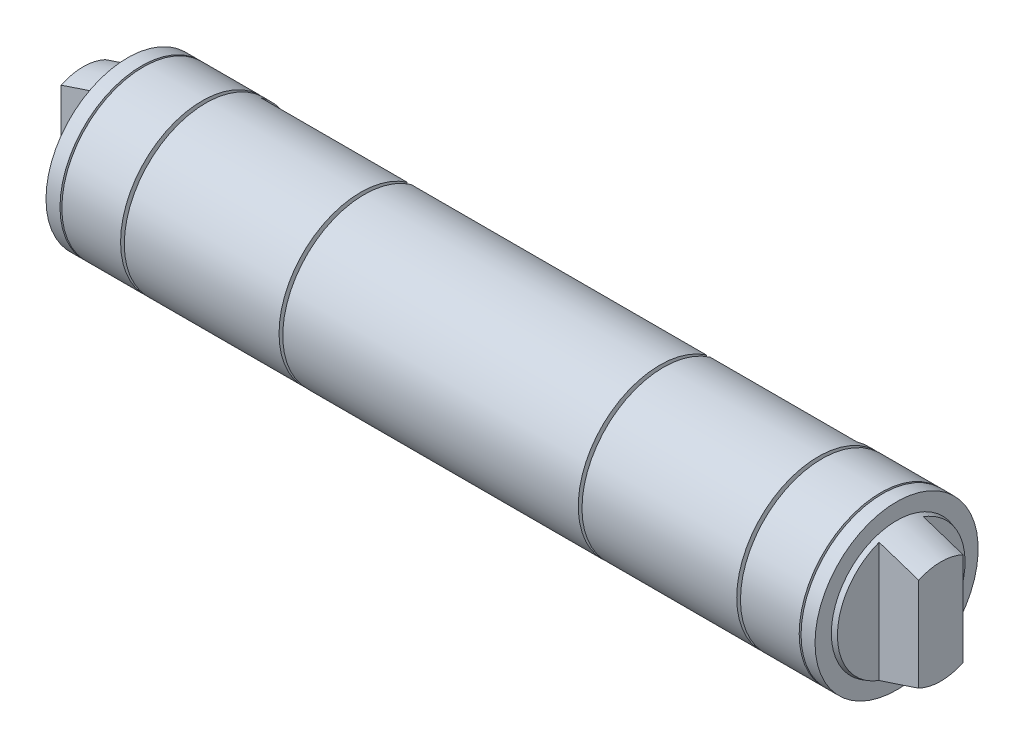
from build123d import *

# Parameters (mm, degrees)
CUT_EXTRUDE_1_DEPTH      = 167.845737135
CUT_EXTRUDE_1_DEPTH_BACK = 167.845737135
SKETCH_2_W               = 128
SKETCH_2_H               = 19.899130277
SKETCH_3_R               = 14
EXTRUDE_1_DEPTH          = 9.5
EXTRUDE_1_TAPER          = 17
SKETCH_4_W               = 17.504538799
SKETCH_4_H               = 43.451593783
CUT_EXTRUDE_2_DEPTH      = 8.5
SKETCH_5_R               = 14
EXTRUDE_2_DEPTH          = 9.5
EXTRUDE_2_TAPER          = 17
SKETCH_6_W               = 11.469588706
SKETCH_6_H               = 34.444631615
CUT_EXTRUDE_3_DEPTH      = 8.5


with BuildPart() as part:
    # Эскиз1 → Повернуть1 (revolve)
    with BuildSketch(Plane(origin=(0, 0, 0), x_dir=(1, 0, 0), z_dir=(0, 1, 0))):
        Polygon((0, 0), (0, 17.5), (3, 17.5), (3, 15.5), (3.4, 15.5), (3.4, 17.5), (16, 17.5), (16, 15.5), (16.8, 15.5), (16.8, 17.5), (50, 17.5), (50, 15.5), (50.8, 15.5), (50.8, 17.5), (114.2, 17.5), (114.2, 15.5), (115, 15.5), (115, 17.5), (148.2, 17.5), (148.2, 15.5), (149, 15.5), (149, 17.5), (161.6, 17.5), (161.6, 15.5), (162, 15.5), (162, 17.5), (165, 17.5), (165, 0), align=None)
    revolve(axis=Axis((0, 0, 0), (1, 0, 0)))

    # Эскиз2 → Вырез-Вытянуть1 (cut, two sides: drawn at the far end of the back side and taken through both)
    with BuildSketch(Plane(origin=(0, 0, 0), x_dir=(1, 0, 0), z_dir=(0, 1, 0)).offset(-CUT_EXTRUDE_1_DEPTH_BACK)):
        with Locations((82.5, 19.949565138)):
            Rectangle(SKETCH_2_W, SKETCH_2_H)
    extrude(amount=CUT_EXTRUDE_1_DEPTH + CUT_EXTRUDE_1_DEPTH_BACK, mode=Mode.SUBTRACT)

    # Эскиз3 → Бобышка-Вытянуть1 (add)
    with BuildSketch(Plane.ZY):
        Circle(SKETCH_3_R)
    extrude(amount=EXTRUDE_1_DEPTH, taper=EXTRUDE_1_TAPER)

    # Эскиз4 → Вырез-Вытянуть2 (cut)
    with BuildSketch(Plane.ZY.offset(9.5)):
        with Locations((-13.5022694, 0.56408101)):
            Rectangle(SKETCH_4_W, SKETCH_4_H)
        with Locations((13.5022694, 0.56408101)):
            Rectangle(SKETCH_4_W, SKETCH_4_H)
    extrude(amount=-CUT_EXTRUDE_2_DEPTH, mode=Mode.SUBTRACT)

    # Эскиз5 → Бобышка-Вытянуть2 (add)
    with BuildSketch(Plane(origin=(165, 0, 0), x_dir=(0, 0, -1), z_dir=(1, 0, 0))):
        Circle(SKETCH_5_R)
    extrude(amount=EXTRUDE_2_DEPTH, taper=EXTRUDE_2_TAPER)

    # Эскиз6 → Вырез-Вытянуть3 (cut)
    with BuildSketch(Plane(origin=(174.5, 0, 0), x_dir=(0, 0, -1), z_dir=(1, 0, 0))):
        with Locations((10.484794353, 0.773198928)):
            Rectangle(SKETCH_6_W, SKETCH_6_H)
        with Locations((-10.484794353, 0.773198928)):
            Rectangle(SKETCH_6_W, SKETCH_6_H)
    extrude(amount=-CUT_EXTRUDE_3_DEPTH, mode=Mode.SUBTRACT)


solid = part.part
